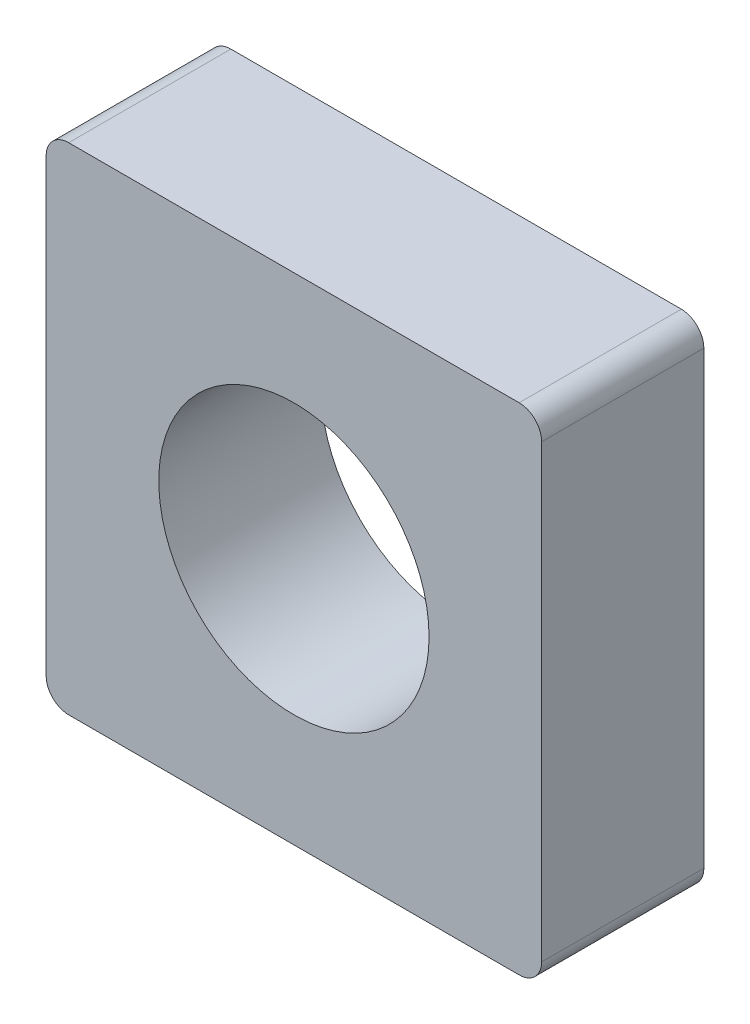
from build123d import *

# Parameters (mm, degrees)
SKETCH1_R           = 1.5
BOSS_EXTRUDE1_DEPTH = 1.8


with BuildPart() as part:
    # Sketch1 → Boss-Extrude1 (new body)
    with BuildSketch(Plane.XY):
        with BuildLine():
            Line((0.25, 0), (5.25, 0))
            ThreePointArc((5.25, 0), (5.426776695, 0.073223305), (5.5, 0.25))
            Line((5.5, 0.25), (5.5, 5.25))
            ThreePointArc((5.5, 5.25), (5.426776695, 5.426776695), (5.25, 5.5))
            Line((5.25, 5.5), (0.25, 5.5))
            ThreePointArc((0.25, 5.5), (0.073223305, 5.426776695), (0, 5.25))
            Line((0, 5.25), (0, 0.25))
            ThreePointArc((0, 0.25), (0.073223305, 0.073223305), (0.25, 0))
        make_face()
        with Locations((2.75, 2.75)):
            Circle(SKETCH1_R, mode=Mode.SUBTRACT)
    extrude(amount=BOSS_EXTRUDE1_DEPTH)


solid = part.part
